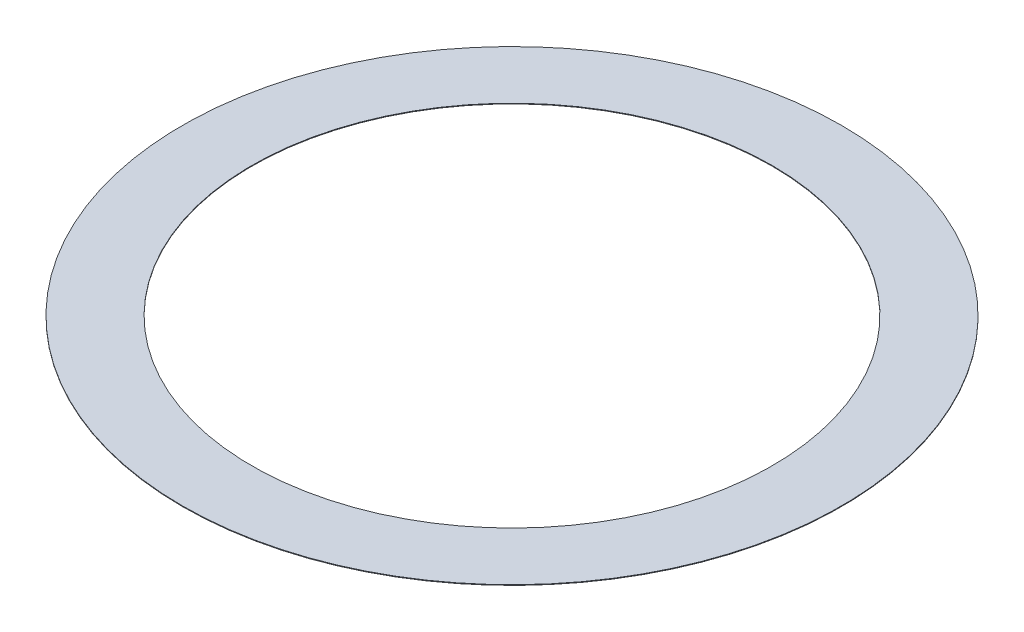
from build123d import *

# Parameters (mm, degrees)
SKETCH1_R           = 20.9
SKETCH1_R_2         = 16.5
BOSS_EXTRUDE1_DEPTH = 0.04


with BuildPart() as part:
    # Sketch1 → Boss-Extrude1 (new body)
    with BuildSketch(Plane(origin=(0, 0, 0), x_dir=(1, 0, 0), z_dir=(0, 1, 0))):
        with Locations(Location((0, 0, 0), (0, 0, 90))):
            Circle(SKETCH1_R)
        with Locations(Location((0, 0, 0), (0, 0, 90))):
            Circle(SKETCH1_R_2, mode=Mode.SUBTRACT)
    extrude(amount=BOSS_EXTRUDE1_DEPTH)


solid = part.part
